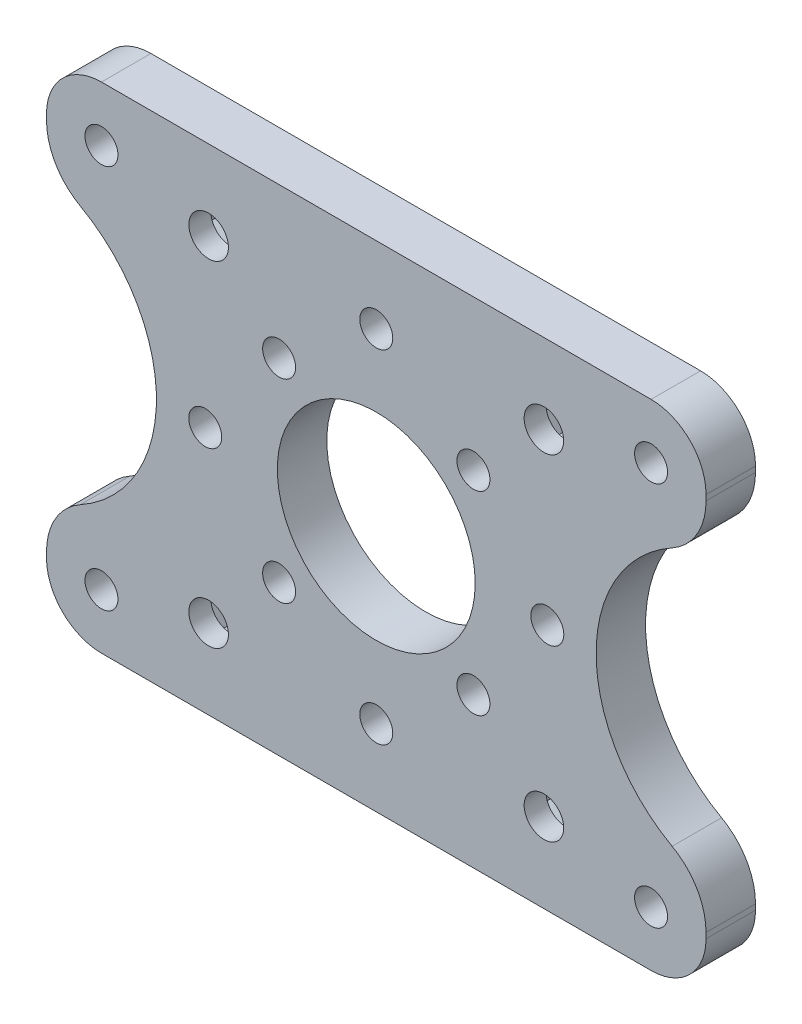
from build123d import *

# Parameters (mm, degrees)
SKETCH_1_W          = 60
SKETCH_1_H          = 45
SKETCH_1_R          = 1.5
SKETCH_1_R_2        = 9
EXTRUDE_1_DEPTH     = 4.5
CUT_EXTRUDE_1_DEPTH = 2
FILLET_1_R          = 5
SKETCH_4_R          = 1.8
CUT_EXTRUDE_2_DEPTH = 4.5
CUT_EXTRUDE_3_DEPTH = 2.5
CUT_EXTRUDE_4_DEPTH = 4.5
FILLET_2_R          = 6


with BuildPart() as part:
    # 草图1 → 凸台-拉伸1 (new body)
    with BuildSketch(Plane.XY):
        Rectangle(SKETCH_1_W, SKETCH_1_H)
        with Locations((8.838834765, 8.838834765)):
            Circle(SKETCH_1_R, mode=Mode.SUBTRACT)
        Circle(SKETCH_1_R_2, mode=Mode.SUBTRACT)
        with Locations((8.838834765, -8.838834765)):
            Circle(SKETCH_1_R, mode=Mode.SUBTRACT)
        with Locations((-8.838834765, -8.838834765)):
            Circle(SKETCH_1_R, mode=Mode.SUBTRACT)
        with Locations((-8.838834765, 8.838834765)):
            Circle(SKETCH_1_R, mode=Mode.SUBTRACT)
        with Locations((0, -15.56)):
            Circle(SKETCH_1_R, mode=Mode.SUBTRACT)
        with Locations((-15.56, 0)):
            Circle(SKETCH_1_R, mode=Mode.SUBTRACT)
        with Locations((0, 15.56)):
            Circle(SKETCH_1_R, mode=Mode.SUBTRACT)
        with Locations((15.56, 0)):
            Circle(SKETCH_1_R, mode=Mode.SUBTRACT)
        with Locations((-25, 17.5)):
            Circle(SKETCH_1_R, mode=Mode.SUBTRACT)
        with Locations((25, 17.5)):
            Circle(SKETCH_1_R, mode=Mode.SUBTRACT)
        with Locations((25, -17.5)):
            Circle(SKETCH_1_R, mode=Mode.SUBTRACT)
        with Locations((-25, -17.5)):
            Circle(SKETCH_1_R, mode=Mode.SUBTRACT)
    extrude(amount=EXTRUDE_1_DEPTH)

    # 草图2 → 切除-拉伸1 (cut)
    with BuildSketch(Plane(origin=(0, 0, 0), x_dir=(-1, 0, 0), z_dir=(0, 0, -1))):
        Polygon((-1.5, -12.961923789), (-3, -15.56), (-1.5, -18.158076211), (1.5, -18.158076211), (3, -15.56), (1.5, -12.961923789), align=None)
        Polygon((12.961923789, -1.5), (15.56, -3), (18.158076211, -1.5), (18.158076211, 1.5), (15.56, 3), (12.961923789, 1.5), align=None)
        Polygon((-12.961923789, 1.5), (-15.56, 3), (-18.158076211, 1.5), (-18.158076211, -1.5), (-15.56, -3), (-12.961923789, -1.5), align=None)
        Polygon((1.5, 12.961923789), (3, 15.56), (1.5, 18.158076211), (-1.5, 18.158076211), (-3, 15.56), (-1.5, 12.961923789), align=None)
    extrude(amount=-CUT_EXTRUDE_1_DEPTH, mode=Mode.SUBTRACT)

    # 圆角1
    fillet_1_edges = [part.edges().sort_by_distance(p)[0] for p in [
        (30, -22.5, 2.25),
        (-30, -22.5, 2.25),
        (-30, 22.5, 2.25),
        (30, 22.5, 2.25),
    ]]
    fillet(fillet_1_edges, radius=FILLET_1_R)

    # 草图4 → 切除-拉伸2 (cut)
    with BuildSketch(Plane.XY.offset(4.5)):
        with Locations((-15.25, 15.25)):
            Circle(SKETCH_4_R)
        with Locations((15.25, 15.25)):
            Circle(SKETCH_4_R)
        with Locations((15.25, -15.25)):
            Circle(SKETCH_4_R)
        with Locations((-15.25, -15.25)):
            Circle(SKETCH_4_R)
    extrude(amount=-CUT_EXTRUDE_2_DEPTH, mode=Mode.SUBTRACT)

    # 草图5 → 切除-拉伸3 (cut)
    with BuildSketch(Plane(origin=(0, 0, 0), x_dir=(-1, 0, 0), z_dir=(0, 0, -1))):
        Polygon((12.651923789, 13.75), (15.25, 12.25), (17.848076211, 13.75), (17.848076211, 16.75), (15.25, 18.25), (12.651923789, 16.75), align=None)
        Polygon((-13.75, 12.651923789), (-12.25, 15.25), (-13.75, 17.848076211), (-16.75, 17.848076211), (-18.25, 15.25), (-16.75, 12.651923789), align=None)
        Polygon((13.75, -12.651923789), (12.25, -15.25), (13.75, -17.848076211), (16.75, -17.848076211), (18.25, -15.25), (16.75, -12.651923789), align=None)
        Polygon((-12.651923789, -13.75), (-15.25, -12.25), (-17.848076211, -13.75), (-17.848076211, -16.75), (-15.25, -18.25), (-12.651923789, -16.75), align=None)
    extrude(amount=-CUT_EXTRUDE_3_DEPTH, mode=Mode.SUBTRACT)

    # 草图6 → 切除-拉伸4 (cut)
    with BuildSketch(Plane(origin=(0, 0, 0), x_dir=(-1, 0, 0), z_dir=(0, 0, -1))):
        with BuildLine():
            Line((-30, 13), (-30, -13))
            ThreePointArc((-30, -13), (-20, 0), (-30, 13))
        make_face()
        with BuildLine():
            Line((30, -13), (30, 13))
            ThreePointArc((30, 13), (20, 0), (30, -13))
        make_face()
    extrude(amount=-CUT_EXTRUDE_4_DEPTH, mode=Mode.SUBTRACT)

    # 圆角2
    fillet_2_edges = [part.edges().sort_by_distance(p)[0] for p in [
        (30, -13, 2.25),
        (30, 13, 2.25),
        (-30, 13, 2.25),
        (-30, -13, 2.25),
    ]]
    fillet(fillet_2_edges, radius=FILLET_2_R)


solid = part.part
